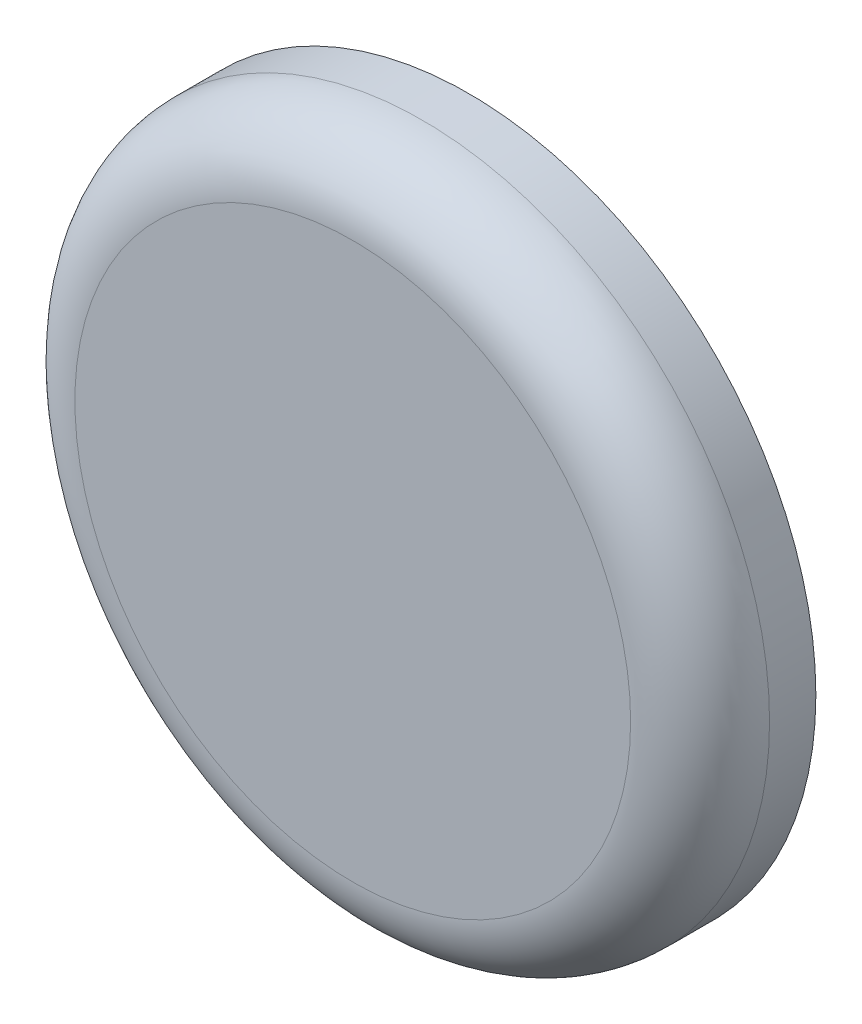
from build123d import *

# Parameters (mm, degrees)
SKETCH1_R           = 15
BOSS_EXTRUDE1_DEPTH = 5
FILLET1_R           = 3


with BuildPart() as part:
    # Sketch1 → Boss-Extrude1 (new body)
    with BuildSketch(Plane.XY):
        Circle(SKETCH1_R)
    extrude(amount=BOSS_EXTRUDE1_DEPTH)

    # Fillet1
    fillet1_edges = [part.edges().sort_by_distance(p)[0] for p in [
        (-15, 0, 5),
    ]]
    fillet(fillet1_edges, radius=FILLET1_R)


solid = part.part
